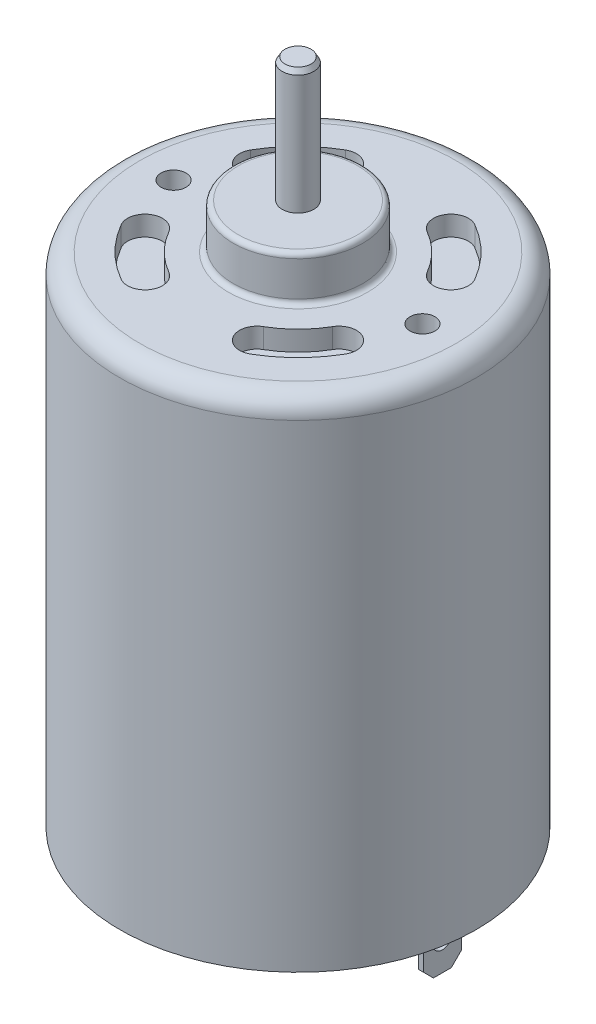
from build123d import *
from OCP.BRepFilletAPI import BRepFilletAPI_MakeChamfer

# Parameters (mm, degrees)
SKETCH3_R          = 1.25
CUT_EXTRUDE2_DEPTH = 5
CUT_EXTRUDE3_DEPTH = 2
CIRPATTERN1_COUNT  = 4
CUT_EXTRUDE4_DEPTH = 1
CIRPATTERN2_COUNT  = 4
SKETCH6_W          = 3.8
SKETCH6_H          = 7.2
SKETCH6_R          = 1
EXTRUDE1_DEPTH     = 0.5
CHAMFER1_SIZE      = 1
FILLET1_R          = 2
FILLET3_R          = 0.5
CHAMFER2_SIZE      = 0.5
CHAMFER2_SIZE2     = 0.288675135


with BuildPart() as part:
    # Sketch1 → Revolve1 (revolve)
    with BuildSketch(Plane.XY):
        Polygon((0, 42), (1.5875, 42), (1.5875, 29.5), (6.5, 29.5), (6.5, 25), (17.9, 25), (17.9, -25), (16.855, -25), (16.855, -23.25), (11.725, -23.25), (11.725, -23.87), (5.1, -23.87), (5.1, -28), (1.5875, -28), (1.5875, -29), (0, -29), align=None)
    revolve(axis=Axis((0, 42, 0), (0, -1, 0)))

    # Sketch3 → Cut-Extrude2 (cut)
    with BuildSketch(Plane(origin=(0, 25, 0), x_dir=(1, 0, 0), z_dir=(0, 1, 0))):
        with Locations((12.5, 0)):
            Circle(SKETCH3_R)
        with Locations((-12.5, 0)):
            Circle(SKETCH3_R)
    extrude(amount=-CUT_EXTRUDE2_DEPTH, mode=Mode.SUBTRACT)

    # Sketch4 → Cut-Extrude3 (cut)
    with BuildSketch(Plane(origin=(0, 25, 0), x_dir=(1, 0, 0), z_dir=(0, 1, 0))):
        with BuildLine():
            ThreePointArc((4.75, 8.227241336), (6.717514421, 6.717514421), (8.227241336, 4.75))
            ThreePointArc((8.227241336, 4.75), (10.617785793, 4.109455543), (11.258330249, 6.5))
            ThreePointArc((11.258330249, 6.5), (9.192388155, 9.192388155), (6.5, 11.258330249))
            ThreePointArc((6.5, 11.258330249), (4.109455543, 10.617785793), (4.75, 8.227241336))
        make_face()
    cut_extrude3 = extrude(amount=-CUT_EXTRUDE3_DEPTH, mode=Mode.SUBTRACT)

    # CirPattern1: Cut-Extrude3 ×4 about axis
    cirpattern1_axis = Axis((0, 42, 0), (0, -1, 0))
    for i in range(1, CIRPATTERN1_COUNT):
        add(cut_extrude3.rotate(cirpattern1_axis, i * 360 / CIRPATTERN1_COUNT), mode=Mode.SUBTRACT)

    # Sketch5 → Cut-Extrude4 (cut)
    with BuildSketch(Plane.XZ.offset(23.87)):
        with BuildLine():
            Line((3.15, 9.359119884), (3.15, 5.685727746))
            ThreePointArc((3.15, 5.685727746), (4.596194078, 4.596194078), (5.685727746, 3.15))
            Line((5.685727746, 3.15), (9.359119884, 3.15))
            ThreePointArc((9.359119884, 3.15), (6.982679464, 6.982679464), (3.15, 9.359119884))
        make_face()
    cut_extrude4 = extrude(amount=-CUT_EXTRUDE4_DEPTH, mode=Mode.SUBTRACT)

    # CirPattern2: Cut-Extrude4 ×4 about axis
    cirpattern2_axis = Axis((0, 23, 0), (0, 1, 0))
    for i in range(1, CIRPATTERN2_COUNT):
        add(cut_extrude4.rotate(cirpattern2_axis, i * 360 / CIRPATTERN2_COUNT), mode=Mode.SUBTRACT)

    # Sketch6 → Extrude1 (add)
    with BuildSketch(Plane(origin=(14, 0, 0), x_dir=(0, 0, -1), z_dir=(1, 0, 0))):
        with Locations((0, -26.85)):
            Rectangle(SKETCH6_W, SKETCH6_H)
        with Locations((0, -27.45)):
            Circle(SKETCH6_R, mode=Mode.SUBTRACT)
    extrude1 = extrude(amount=EXTRUDE1_DEPTH)

    # Mirror1: Extrude1 across plane
    add(extrude1.mirror(Plane(origin=(0, 0, 0), x_dir=(0, 0, 1), z_dir=(1, 0, 0))))

    # Chamfer1
    chamfer1_edges = [part.edges().sort_by_distance(p)[0] for p in [
        (-14.25, -30.45, 1.9),
        (-14.25, -30.45, -1.9),
        (14.25, -30.45, 1.9),
        (14.25, -30.45, -1.9),
    ]]
    chamfer(chamfer1_edges, length=CHAMFER1_SIZE)

    # Fillet1
    fillet1_edges = [part.edges().sort_by_distance(p)[0] for p in [
        (-17.9, 25, 0),
    ]]
    fillet(fillet1_edges, radius=FILLET1_R)

    # Fillet3
    fillet3_edges = [part.edges().sort_by_distance(p)[0] for p in [
        (-6.5, 25, 0),
        (-6.5, 29.5, 0),
    ]]
    fillet(fillet3_edges, radius=FILLET3_R)

    # Chamfer2: one chamfer whose edges measure the first distance from different faces: ONE call of the kernel's chamfer builder (chamfer() names one face for all edges)
    chamfer2_edges_1 = [part.edges().sort_by_distance(p)[0] for p in [
        (-1.5875, 42, 0),
    ]]
    chamfer2_side_1 = [part.faces().sort_by_distance(p)[0] for p in [
        (-1.5875, 35.75, 0),
    ]]
    chamfer2_edges_2 = [part.edges().sort_by_distance(p)[0] for p in [
        (-1.5875, -29, 0),
    ]]
    chamfer2_side_2 = [part.faces().sort_by_distance(p)[0] for p in [
        (0, -29, 0),
    ]]
    chamfer2 = BRepFilletAPI_MakeChamfer(part.part.solid().wrapped)
    for e in chamfer2_edges_1:
        chamfer2.Add(CHAMFER2_SIZE, CHAMFER2_SIZE2, e.wrapped, chamfer2_side_1[0].wrapped)  # the first distance lies on this face
    for e in chamfer2_edges_2:
        chamfer2.Add(CHAMFER2_SIZE, CHAMFER2_SIZE2, e.wrapped, chamfer2_side_2[0].wrapped)  # the first distance lies on this face
    add(Compound.cast(chamfer2.Shape()), mode=Mode.REPLACE)


solid = part.part
